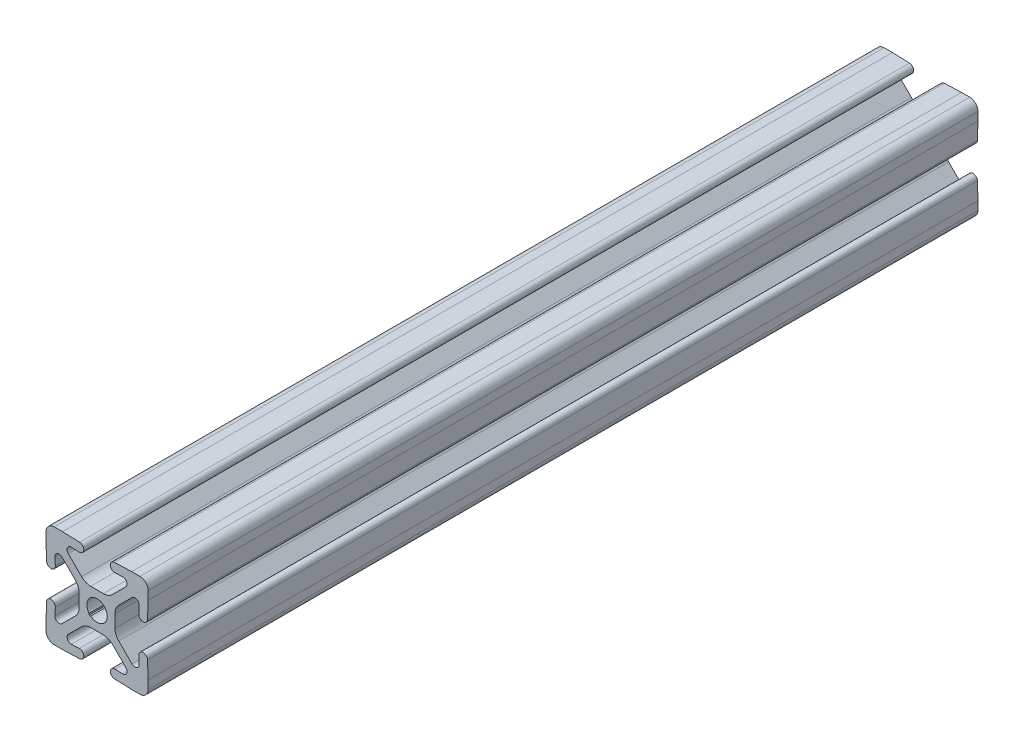
from build123d import *

# Parameters (mm, degrees)
BOSS_EXTRUDE1_DEPTH = 203.2


with BuildPart() as part:
    # Model → Boss-Extrude1 (new body)
    with BuildSketch(Plane.XY):
        with BuildLine():
            Line((50.659960212, 72.999871414), (53.774553856, 72.999871414))
            ThreePointArc((53.774553856, 72.999871414), (54.989573754, 72.758188929), (56.019617887, 72.069935444))
            Line((56.019617887, 72.069935444), (59.264200891, 68.825352439))
            ThreePointArc((59.264200891, 68.825352439), (59.477513437, 67.701802895), (58.510322513, 67.091550869))
            Line((58.510322513, 67.091550869), (56.572487817, 67.159221548))
            ThreePointArc((56.572487817, 67.159221548), (55.4691069, 66.130302197), (56.498026251, 65.026921279))
            Line((56.498026251, 65.026921279), (60.677257034, 64.880979325))
            Line((60.677257034, 64.880979325), (62.710657034, 64.880979325))
            ThreePointArc((62.710657034, 64.880979325), (64.129537501, 65.468698857), (64.717257034, 66.887579325))
            Line((64.717257034, 66.887579325), (64.717257034, 68.920979325))
            Line((64.717257034, 68.920979325), (64.57131508, 73.100210108))
            ThreePointArc((64.57131508, 73.100210108), (63.467934162, 74.129129459), (62.439014811, 73.025748542))
            Line((62.439014811, 73.025748542), (62.50668549, 71.087913846))
            ThreePointArc((62.50668549, 71.087913846), (61.896433464, 70.120722922), (60.77288392, 70.334035468))
            Line((60.77288392, 70.334035468), (57.528300915, 73.578618472))
            ThreePointArc((57.528300915, 73.578618472), (56.84004743, 74.608662605), (56.598364945, 75.823682503))
            Line((56.598364945, 75.823682503), (56.598364945, 78.938276147))
            ThreePointArc((56.598364945, 78.938276147), (56.84004743, 80.153296044), (57.528300915, 81.183340177))
            Line((57.528300915, 81.183340177), (60.77288392, 84.427923182))
            ThreePointArc((60.77288392, 84.427923182), (61.896433464, 84.641235728), (62.50668549, 83.674044803))
            Line((62.50668549, 83.674044803), (62.439014811, 81.736210108))
            ThreePointArc((62.439014811, 81.736210108), (63.467934162, 80.63282919), (64.57131508, 81.661748542))
            Line((64.57131508, 81.661748542), (64.717257034, 85.840979325))
            Line((64.717257034, 85.840979325), (64.717257034, 87.874379325))
            ThreePointArc((64.717257034, 87.874379325), (64.129537501, 89.293259792), (62.710657034, 89.880979325))
            Line((62.710657034, 89.880979325), (60.677257034, 89.880979325))
            Line((60.677257034, 89.880979325), (56.498026251, 89.73503737))
            ThreePointArc((56.498026251, 89.73503737), (55.4691069, 88.631656452), (56.572487817, 87.602737101))
            Line((56.572487817, 87.602737101), (58.510322513, 87.67040778))
            ThreePointArc((58.510322513, 87.67040778), (59.477513437, 87.060155754), (59.264200891, 85.93660621))
            Line((59.264200891, 85.93660621), (56.019617887, 82.692023205))
            ThreePointArc((56.019617887, 82.692023205), (54.989573754, 82.00376972), (53.774553856, 81.762087236))
            Line((53.774553856, 81.762087236), (50.659960212, 81.762087236))
            ThreePointArc((50.659960212, 81.762087236), (49.444940315, 82.00376972), (48.414896182, 82.692023205))
            Line((48.414896182, 82.692023205), (45.170313177, 85.93660621))
            ThreePointArc((45.170313177, 85.93660621), (44.957000631, 87.060155754), (45.924191556, 87.67040778))
            Line((45.924191556, 87.67040778), (47.862026251, 87.602737101))
            ThreePointArc((47.862026251, 87.602737101), (48.965407169, 88.631656452), (47.936487817, 89.73503737))
            Line((47.936487817, 89.73503737), (43.757257034, 89.880979325))
            Line((43.757257034, 89.880979325), (41.723857034, 89.880979325))
            ThreePointArc((41.723857034, 89.880979325), (40.304976567, 89.293259792), (39.717257034, 87.874379325))
            Line((39.717257034, 87.874379325), (39.717257034, 85.840979325))
            Line((39.717257034, 85.840979325), (39.863198989, 81.661748542))
            ThreePointArc((39.863198989, 81.661748542), (40.966579907, 80.63282919), (41.995499258, 81.736210108))
            Line((41.995499258, 81.736210108), (41.927828579, 83.674044803))
            ThreePointArc((41.927828579, 83.674044803), (42.538080605, 84.641235728), (43.661630149, 84.427923182))
            Line((43.661630149, 84.427923182), (46.906213154, 81.183340177))
            ThreePointArc((46.906213154, 81.183340177), (47.594466639, 80.153296044), (47.836149123, 78.938276147))
            Line((47.836149123, 78.938276147), (47.836149123, 75.823682503))
            ThreePointArc((47.836149123, 75.823682503), (47.594466639, 74.608662605), (46.906213154, 73.578618472))
            Line((46.906213154, 73.578618472), (43.661630149, 70.334035468))
            ThreePointArc((43.661630149, 70.334035468), (42.538080605, 70.120722922), (41.927828579, 71.087913846))
            Line((41.927828579, 71.087913846), (41.995499258, 73.025748542))
            ThreePointArc((41.995499258, 73.025748542), (40.966579907, 74.129129459), (39.863198989, 73.100210108))
            Line((39.863198989, 73.100210108), (39.717257034, 68.920979325))
            Line((39.717257034, 68.920979325), (39.717257034, 66.887579325))
            ThreePointArc((39.717257034, 66.887579325), (40.304976567, 65.468698857), (41.723857034, 64.880979325))
            Line((41.723857034, 64.880979325), (43.757257034, 64.880979325))
            Line((43.757257034, 64.880979325), (47.936487817, 65.026921279))
            ThreePointArc((47.936487817, 65.026921279), (48.965407169, 66.130302197), (47.862026251, 67.159221548))
            Line((47.862026251, 67.159221548), (45.924191556, 67.091550869))
            ThreePointArc((45.924191556, 67.091550869), (44.957000631, 67.701802895), (45.170313177, 68.825352439))
            Line((45.170313177, 68.825352439), (48.414896182, 72.069935444))
            ThreePointArc((48.414896182, 72.069935444), (49.444940315, 72.758188929), (50.659960212, 72.999871414))
        make_face()
        with BuildLine():
            Line((50.64953831, 75.433607249), (50.269884959, 75.433607249))
            Line((50.269884959, 75.433607249), (50.269884959, 75.8132606))
            ThreePointArc((50.269884959, 75.8132606), (53.985023987, 79.148746278), (50.64953831, 75.433607249))
        make_face(mode=Mode.SUBTRACT)
    extrude(amount=BOSS_EXTRUDE1_DEPTH)


solid = part.part
